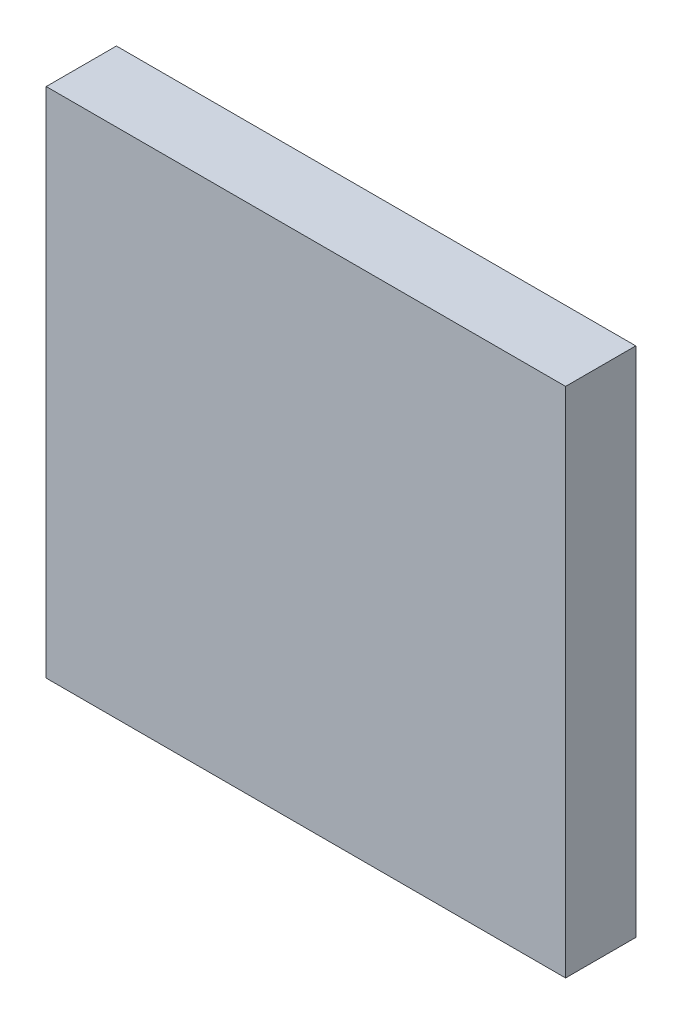
from build123d import *

# Parameters (mm, degrees)
SKETCH_1_W              = 7.4
SKETCH_1_H              = 7.3
COMPONENT_OUTLINE_DEPTH = 1


with BuildPart() as part:
    # 草图1 → Component_Outline (new body)
    with BuildSketch(Plane.XY):
        Rectangle(SKETCH_1_W, SKETCH_1_H)
    extrude(amount=COMPONENT_OUTLINE_DEPTH)


solid = part.part
